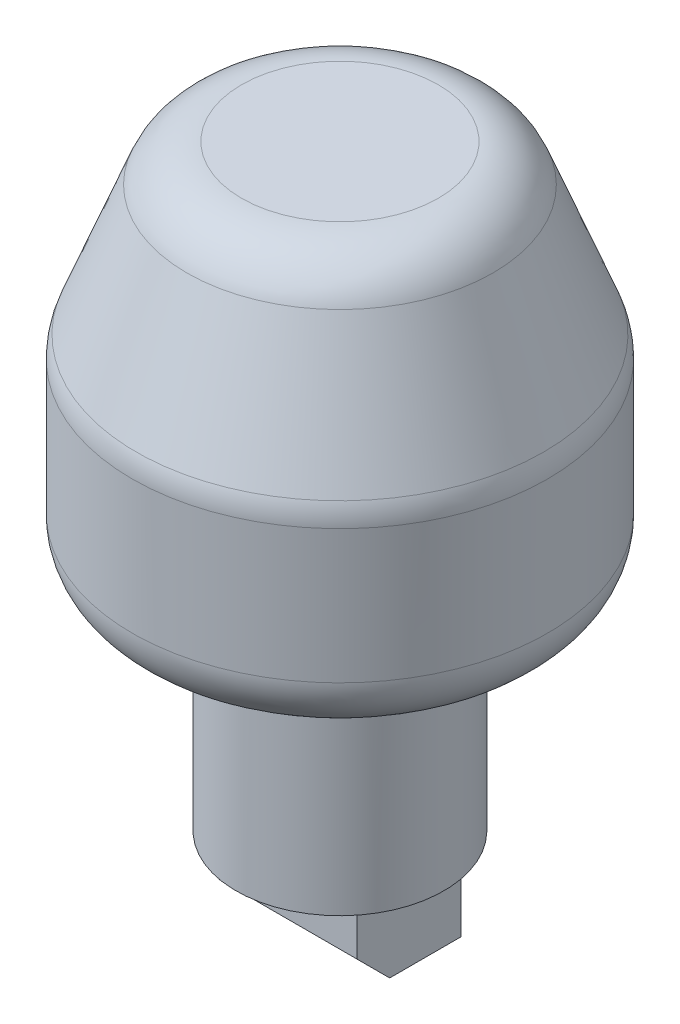
from build123d import *

# Parameters (mm, degrees)
FILLET2_R                = 6.35
BOSS_EXTRUDE1_DEPTH      = 7.4549
SKETCH3_W                = 4.78028
SKETCH3_H                = 7.4422
SKETCH3_W_2              = 4.84124
CUT_EXTRUDE1_DEPTH       = 2.54
BOSS_EXTRUDE2_REACH      = 88.307
BOSS_EXTRUDE2_END_RADIUS = 11.2395
BOSS_EXTRUDE2_START      = 14.29512
SKETCH4_W                = 3.556
SKETCH4_H                = 2.1844


with BuildPart() as part:
    # Sketch1 → Revolve1 (revolve)
    with BuildSketch(Plane.XY, mode=Mode.PRIVATE) as revolve1_sk:
        Polygon((0, 0), (11.2395, 0), (11.2395, 23.4188), (22.473370688, 23.4188), (22.473370688, 45.4152), (14.986, 64.619312752), (0, 64.619312752), align=None)
    revolve(revolve1_sk.sketch.rotate(Axis((0, 64.619312752, 0), (0, -1, 0)), 180), axis=Axis((0, 64.619312752, 0), (0, -1, 0)))

    # Fillet2
    fillet2_edges = [part.edges().sort_by_distance(p)[0] for p in [
        (14.986, 64.619312752, 0),
        (22.473370688, 45.4152, 0),
        (22.473370688, 23.4188, 0),
    ]]
    fillet(fillet2_edges, radius=FILLET2_R)

    # Sketch2 → Boss-Extrude1 (add, symmetric)
    with BuildSketch(Plane(origin=(0, 0, 0), x_dir=(0, 0, -1), z_dir=(1, 0, 0))):
        Polygon((-5.626190712, 0), (5.626190712, 0), (5.626190712, -9.017181424), (-2.070009288, -9.017181424), (-5.626190712, -5.461), align=None)
    extrude(amount=BOSS_EXTRUDE1_DEPTH, both=True)

    # Sketch3 → Cut-Extrude1 (cut)
    with BuildSketch(Plane.XZ.offset(9.017181424)):
        with Locations((-4.93776, -1.778090712)):
            Rectangle(SKETCH3_W, SKETCH3_H)
        with Locations((0, -1.778090712)):
            Rectangle(SKETCH3_W_2, SKETCH3_H)
        with Locations((4.93776, -1.778090712)):
            Rectangle(SKETCH3_W, SKETCH3_H)
    extrude(amount=-CUT_EXTRUDE1_DEPTH, mode=Mode.SUBTRACT)

    # Boss-Extrude2: up to this cylinder (the profile starts outside it)
    boss_extrude2_end = Plane(origin=(0, 22.3266, 0), z_dir=(0, 1, 0)) * Cylinder(BOSS_EXTRUDE2_END_RADIUS, 200.093, mode=Mode.PRIVATE)
    # Sketch4 → Boss-Extrude2 (add, up to the surface)
    with BuildSketch(Plane.XY.offset(BOSS_EXTRUDE2_START), mode=Mode.PRIVATE) as boss_extrude2_sk1:
        with Locations((0, 22.3266)):
            Rectangle(SKETCH4_W, SKETCH4_H)
    boss_extrude2_tool1 = extrude(boss_extrude2_sk1.sketch, amount=-BOSS_EXTRUDE2_REACH, mode=Mode.PRIVATE) - boss_extrude2_end
    add(boss_extrude2_tool1.solids().sort_by_distance((0, 22.3266, 14.29512))[0])


solid = part.part
